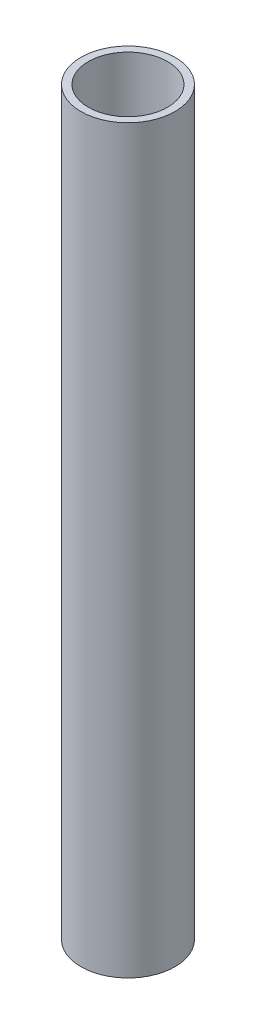
from build123d import *

# Parameters (mm, degrees)
SKETCH1_R           = 12.7
SKETCH1_R_2         = 10.7
BOSS_EXTRUDE1_DEPTH = 200


with BuildPart() as part:
    # Sketch1 → Boss-Extrude1 (new body)
    with BuildSketch(Plane(origin=(0, 0, 0), x_dir=(1, 0, 0), z_dir=(0, 1, 0))):
        with Locations(Location((0, 0, 0), (0, 0, 270))):
            Circle(SKETCH1_R)
        with Locations(Location((0, 0, 0), (0, 0, 270))):
            Circle(SKETCH1_R_2, mode=Mode.SUBTRACT)
    extrude(amount=BOSS_EXTRUDE1_DEPTH)


solid = part.part
